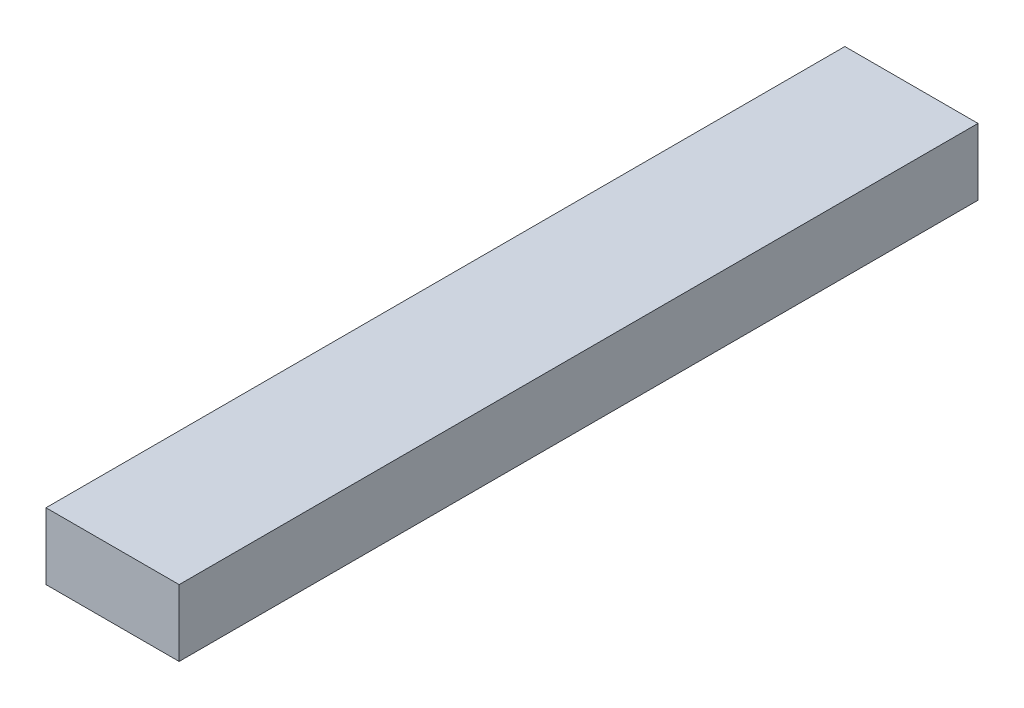
from build123d import *

# Parameters (mm, degrees)
SKETCH1_W           = 101.6
SKETCH1_H           = 50.8
BOSS_EXTRUDE1_DEPTH = 609.6


with BuildPart() as part:
    # Sketch1 → Boss-Extrude1 (new body)
    with BuildSketch(Plane.XY):
        with Locations((-23.750649351, -3.298701299)):
            Rectangle(SKETCH1_W, SKETCH1_H)
    extrude(amount=BOSS_EXTRUDE1_DEPTH)


solid = part.part
